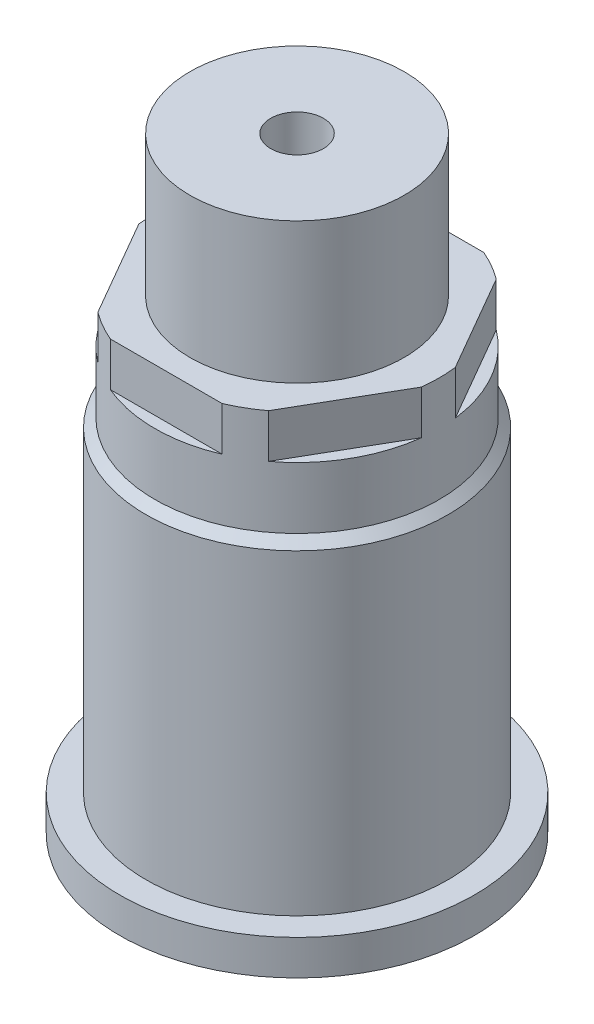
from build123d import *

# Parameters (mm, degrees)
SKETCH2_R               = 12.827
CUT_EXTRUDE1_DEPTH      = 3.175
CUT_EXTRUDE2_DEPTH      = 48.421704767
CUT_EXTRUDE2_DEPTH_BACK = 33.02
SKETCH3_R               = 1.905


with BuildPart() as part:
    # Sketch1 → Revolve1 (revolve)
    with BuildSketch(Plane.XY, mode=Mode.PRIVATE) as revolve1_sk:
        Polygon((0, 0), (11.557, 0), (11.557, -1.27), (12.827, -1.27), (12.827, 1.27), (10.922, 1.27), (10.922, 24.13), (10.287, 24.765), (10.287, 32.385), (7.747, 32.385), (7.747, 42.545), (0, 42.545), (0, 32.385), align=None)
    revolve(revolve1_sk.sketch.rotate(Axis((0, 0, 0), (0, 1, 0)), 90), axis=Axis((0, 0, 0), (0, 1, 0)))

    # Sketch2 → Cut-Extrude1 (cut)
    with BuildSketch(Plane(origin=(0, 32.385, 0), x_dir=(1, 0, 0), z_dir=(0, 1, 0))):
        with Locations(Location((0, 0, 0), (0, 0, 90))):
            Circle(SKETCH2_R)
        Polygon((-10.922, 0), (-5.461, -9.45872946), (5.461, -9.45872946), (10.922, 0), (5.461, 9.45872946), (-5.461, 9.45872946), align=None, mode=Mode.SUBTRACT)
    extrude(amount=-CUT_EXTRUDE1_DEPTH, mode=Mode.SUBTRACT)

    # Sketch3 → Cut-Extrude2 (cut, two sides: drawn at the far end of the back side and taken through both)
    with BuildSketch(Plane(origin=(0, 42.545, 0), x_dir=(1, 0, 0), z_dir=(0, 1, 0)).offset(-CUT_EXTRUDE2_DEPTH_BACK)):
        with Locations(Location((0, 0, 0), (0, 0, 90))):
            Circle(SKETCH3_R)
    extrude(amount=CUT_EXTRUDE2_DEPTH + CUT_EXTRUDE2_DEPTH_BACK, mode=Mode.SUBTRACT)


solid = part.part
